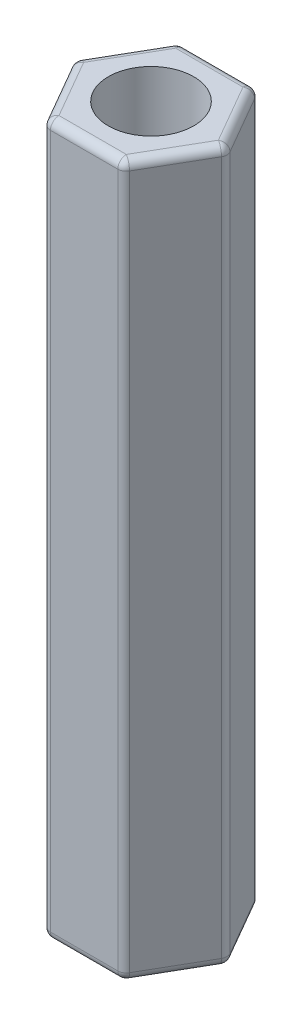
from build123d import *

# Parameters (mm, degrees)
SKETCH_1_R      = 1.5
EXTRUDE_1_DEPTH = 25
FILLET_1_R      = 0.3


with BuildPart() as part:
    # 草图1 → 凸台-拉伸1 (new body)
    with BuildSketch(Plane(origin=(0, 0, 0), x_dir=(1, 0, 0), z_dir=(0, 1, 0))):
        Polygon((2.713546265, 0), (1.356773133, 2.35), (-1.356773133, 2.35), (-2.713546265, 0), (-1.356773133, -2.35), (1.356773133, -2.35), align=None)
        with Locations(Location((0, 0, 0), (0, 0, 270))):
            Circle(SKETCH_1_R, mode=Mode.SUBTRACT)
    extrude(amount=EXTRUDE_1_DEPTH)

    # 圆角1
    fillet_1_edges = [part.edges().sort_by_distance(p)[0] for p in [
        (0, 25, -2.35),
        (1.356773133, 12.5, 2.35),
        (-1.356773133, 12.5, 2.35),
        (-2.713546265, 12.5, 0),
        (-1.356773133, 12.5, -2.35),
        (1.356773133, 12.5, -2.35),
        (2.713546265, 12.5, 0),
        (-2.035159699, 25, -1.175),
        (-2.035159699, 25, 1.175),
        (0, 25, 2.35),
        (2.035159699, 25, 1.175),
        (0, 0, 2.35),
        (-2.035159699, 0, 1.175),
        (-2.035159699, 0, -1.175),
        (2.035159699, 25, -1.175),
        (0, 0, -2.35),
        (2.035159699, 0, -1.175),
        (2.035159699, 0, 1.175),
    ]]
    fillet(fillet_1_edges, radius=FILLET_1_R)


solid = part.part
